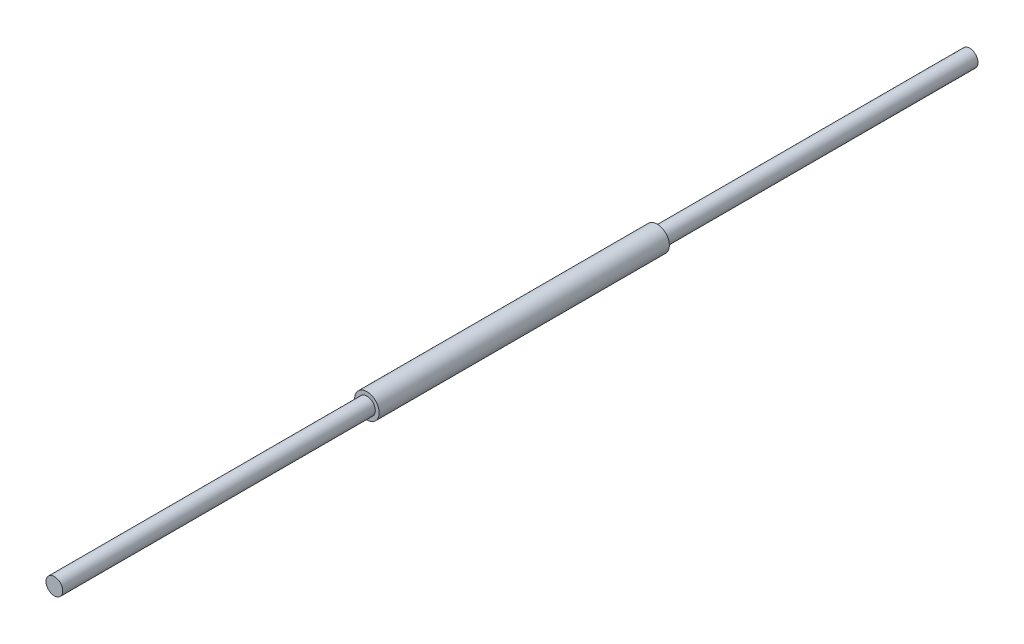
from build123d import *


with BuildPart() as part:
    # Sketch1 → Revolve1 (revolve)
    with BuildSketch(Plane(origin=(0, 0, 0), x_dir=(0, 0, -1), z_dir=(1, 0, 0)), mode=Mode.PRIVATE) as revolve1_sk:
        Polygon((-82.55, 6.985), (82.55, 6.985), (82.55, 4.7625), (260.35, 4.7625), (260.35, 0), (-260.35, 0), (-260.35, 4.7625), (-82.55, 4.7625), align=None)
    revolve(revolve1_sk.sketch.rotate(Axis((0, 0, -260.35), (0, 0, 1)), 90), axis=Axis((0, 0, -260.35), (0, 0, 1)))


solid = part.part
